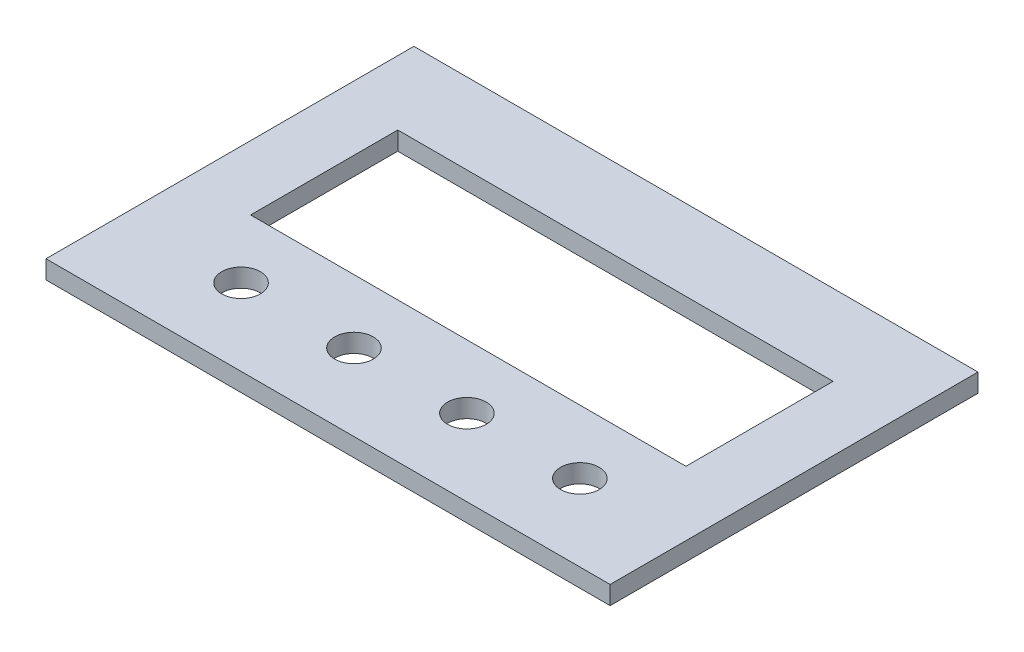
from build123d import *

# Parameters (mm, degrees)
SKETCH1_W           = 92
SKETCH1_H           = 60
SKETCH1_R           = 3.15
SKETCH1_W_2         = 71
SKETCH1_H_2         = 24
BOSS_EXTRUDE1_DEPTH = 3


with BuildPart() as part:
    # Sketch1 → Boss-Extrude1 (new body)
    with BuildSketch(Plane(origin=(0, 0, 0), x_dir=(1, 0, 0), z_dir=(0, 1, 0))):
        Rectangle(SKETCH1_W, SKETCH1_H)
        with Locations(Location((-26.7, -17.491017964, 0), (0, 0, 270))):
            Circle(SKETCH1_R, mode=Mode.SUBTRACT)
        with Locations(Location((-8.28, -17.491017964, 0), (0, 0, 270))):
            Circle(SKETCH1_R, mode=Mode.SUBTRACT)
        with Locations(Location((10.14, -17.491017964, 0), (0, 0, 270))):
            Circle(SKETCH1_R, mode=Mode.SUBTRACT)
        with Locations(Location((28.56, -17.491017964, 0), (0, 0, 270))):
            Circle(SKETCH1_R, mode=Mode.SUBTRACT)
        with Locations((0, 4.87)):
            Rectangle(SKETCH1_W_2, SKETCH1_H_2, mode=Mode.SUBTRACT)
    extrude(amount=BOSS_EXTRUDE1_DEPTH)


solid = part.part
